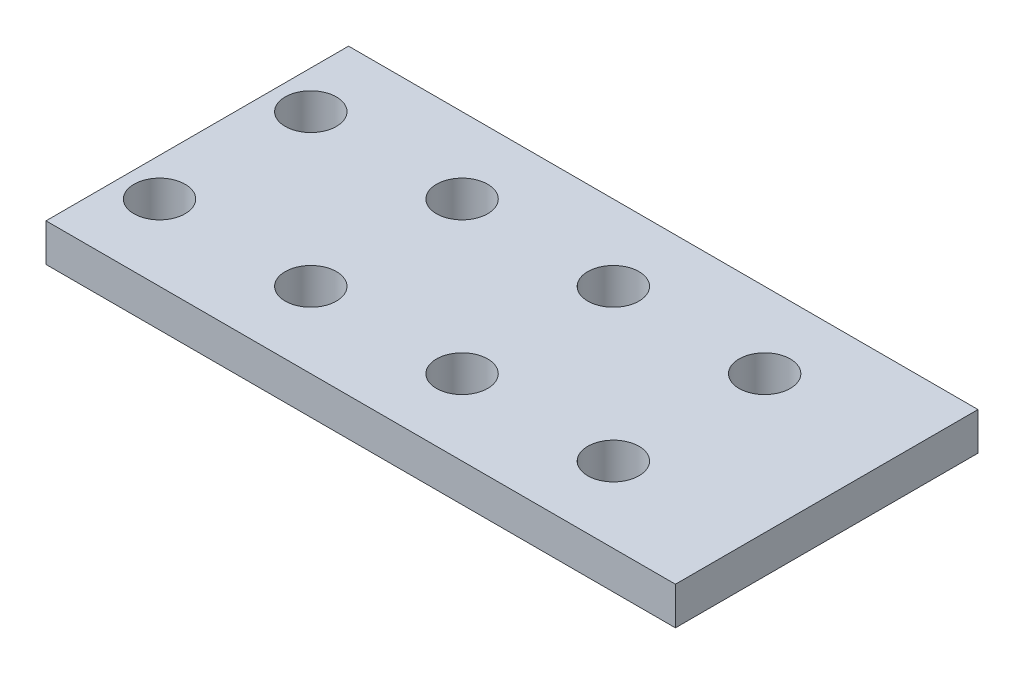
from build123d import *

# Parameters (mm, degrees)
SKETCH1_W           = 52.84
SKETCH1_H           = 25.4
SKETCH1_R           = 2.15
BOSS_EXTRUDE2_DEPTH = 3.175


with BuildPart() as part:
    # Sketch1 → Boss-Extrude2 (new body)
    with BuildSketch(Plane(origin=(0, 0, 0), x_dir=(1, 0, 0), z_dir=(0, 1, 0))):
        with Locations((46.42, 0)):
            Rectangle(SKETCH1_W, SKETCH1_H)
        with Locations(Location((23.18, -6.35, 0), (0, 0, 270))):
            Circle(SKETCH1_R, mode=Mode.SUBTRACT)
        with Locations(Location((35.88, -6.35, 0), (0, 0, 270))):
            Circle(SKETCH1_R, mode=Mode.SUBTRACT)
        with Locations(Location((48.58, -6.35, 0), (0, 0, 270))):
            Circle(SKETCH1_R, mode=Mode.SUBTRACT)
        with Locations(Location((61.28, -6.35, 0), (0, 0, 270))):
            Circle(SKETCH1_R, mode=Mode.SUBTRACT)
        with Locations(Location((23.18, 6.35, 0), (0, 0, 270))):
            Circle(SKETCH1_R, mode=Mode.SUBTRACT)
        with Locations(Location((35.88, 6.35, 0), (0, 0, 270))):
            Circle(SKETCH1_R, mode=Mode.SUBTRACT)
        with Locations(Location((48.58, 6.35, 0), (0, 0, 270))):
            Circle(SKETCH1_R, mode=Mode.SUBTRACT)
        with Locations(Location((61.28, 6.35, 0), (0, 0, 270))):
            Circle(SKETCH1_R, mode=Mode.SUBTRACT)
    extrude(amount=BOSS_EXTRUDE2_DEPTH)


solid = part.part
